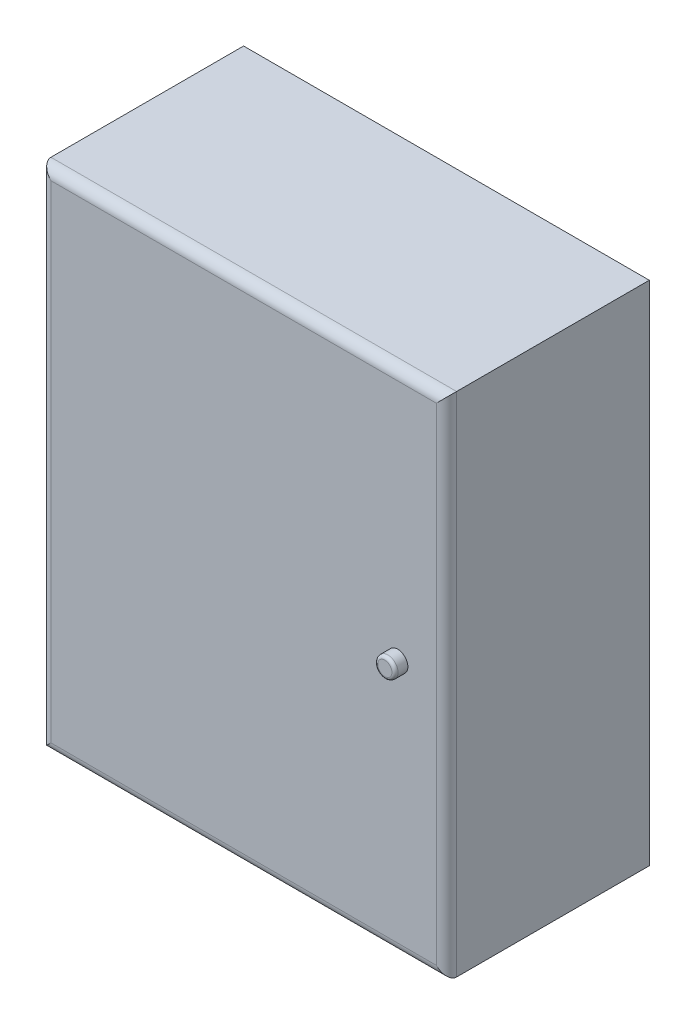
from build123d import *

# Parameters (mm, degrees)
CROQUIS1_W              = 400
CROQUIS1_H              = 500
SALIENTE_EXTRUIR1_DEPTH = 200
REDONDEO1_R             = 10
CROQUIS2_R              = 10
SALIENTE_EXTRUIR2_DEPTH = 12.7
REDONDEO2_R             = 3


with BuildPart() as part:
    # Croquis1 → Saliente-Extruir1 (new body)
    with BuildSketch(Plane.XY):
        with Locations((200, 250)):
            Rectangle(CROQUIS1_W, CROQUIS1_H)
    extrude(amount=SALIENTE_EXTRUIR1_DEPTH)

    # Redondeo1
    redondeo1_edges = [part.edges().sort_by_distance(p)[0] for p in [
        (400, 250, 200),
        (200, 500, 200),
        (0, 250, 200),
        (200, 0, 200),
    ]]
    fillet(redondeo1_edges, radius=REDONDEO1_R)

    # Croquis2 → Saliente-Extruir2 (add)
    with BuildSketch(Plane.XY.offset(200)):
        with Locations(Location((351.956210027, 250.916140829, 0), (0, 0, 180))):
            Circle(CROQUIS2_R)
    extrude(amount=SALIENTE_EXTRUIR2_DEPTH)

    # Redondeo2
    redondeo2_edges = [part.edges().sort_by_distance(p)[0] for p in [
        (361.956210027, 250.916140829, 212.7),
    ]]
    fillet(redondeo2_edges, radius=REDONDEO2_R)


solid = part.part
